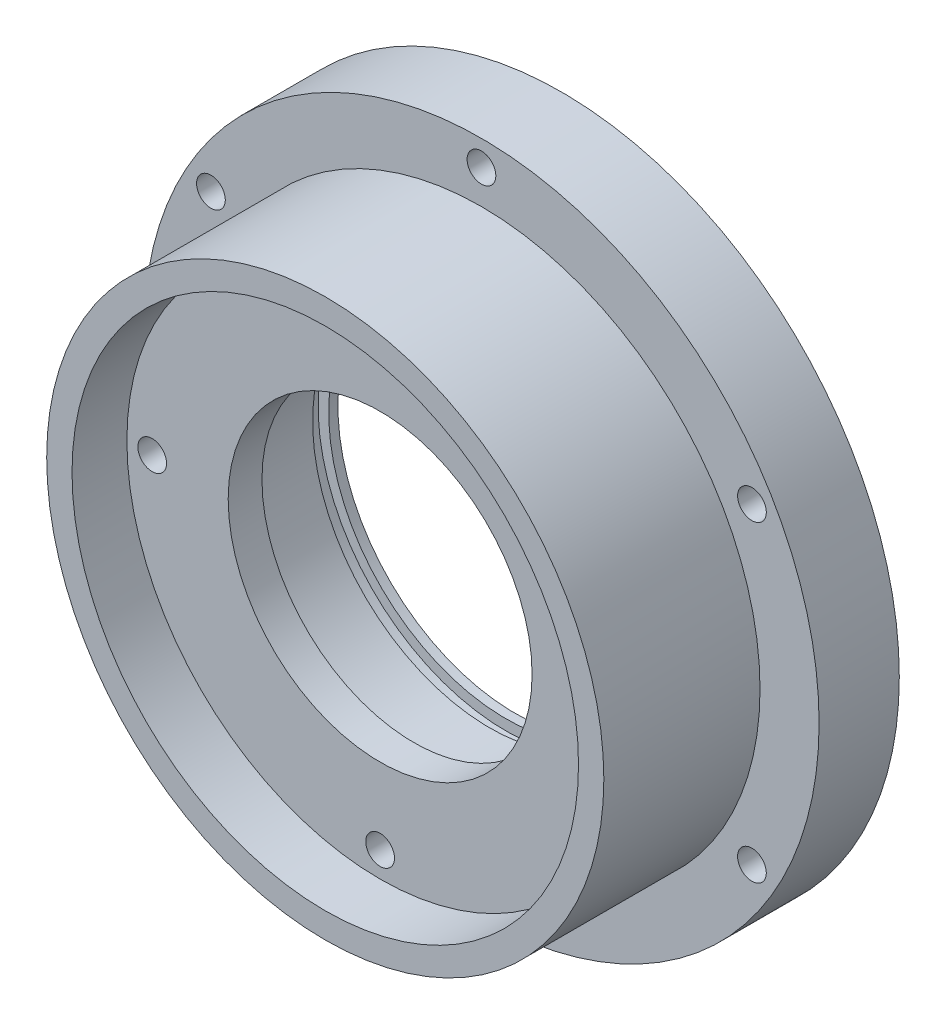
from build123d import *

# Parameters (mm, degrees)
SKETCH_6_R               = 1.7
CUT_EXTRUDE_1_DEPTH      = 64.118935352
PATTERN_CIRCULAR_1_COUNT = 6
CHAMFER_1_SIZE           = 0.5
PATTERN_CIRCULAR_2_COUNT = 4


with BuildPart() as part:
    # 草图1 → 旋转1 (revolve)
    with BuildSketch(Plane(origin=(0, 0, 0), x_dir=(0, 0, -1), z_dir=(1, 0, 0))):
        Polygon((0, 30), (0, 18), (4, 18), (4, 21), (13, 21), (13, 22.25), (14.9, 22.25), (14.9, 21), (16, 21), (16, 33), (21.5, 33), (21.5, 40), (12, 40), (12, 33), (-6.5, 33), (-6.5, 30), align=None)
    revolve(axis=Axis((0, 0, 0), (0, 0, -1)))

    # 草图2 → 切除-旋转2 (revolve, cut)
    with BuildSketch(Plane(origin=(0, 0, 0), x_dir=(0, 0, -1), z_dir=(1, 0, 0))):
        Polygon((0, 27), (16, 27), (16, 30), (4, 30), (4, 28.7), (0, 28.7), align=None)
    cut_revolve_2 = revolve(axis=Axis((0, 27, 0), (0, 0, -1)), mode=Mode.SUBTRACT)

    # 草图6 → 切除-拉伸1 (cut, symmetric)
    with BuildSketch(Plane(origin=(0, 0, -21.5), x_dir=(-1, 0, 0), z_dir=(0, 0, -1))):
        with Locations((0, 37)):
            Circle(SKETCH_6_R)
    cut_extrude_1 = extrude(amount=CUT_EXTRUDE_1_DEPTH, both=True, mode=Mode.SUBTRACT)

    # 阵列(圆周)1: 切除-拉伸1 ×6 about axis
    pattern_circular_1_axis = Axis((0, 0, -22.986810874), (0, 0, 1))
    for i in range(1, PATTERN_CIRCULAR_1_COUNT):
        add(cut_extrude_1.rotate(pattern_circular_1_axis, i * 360 / PATTERN_CIRCULAR_1_COUNT), mode=Mode.SUBTRACT)

    # 倒角1
    chamfer_1_edges = [part.edges().sort_by_distance(p)[0] for p in [
        (0, -33, -21.5),
    ]]
    chamfer(chamfer_1_edges, length=CHAMFER_1_SIZE)

    # 阵列(圆周)2: 切除-旋转2 ×4 about axis
    pattern_circular_2_axis = Axis((0, 0, -16), (0, 0, 1))
    for i in range(1, PATTERN_CIRCULAR_2_COUNT):
        add(cut_revolve_2.rotate(pattern_circular_2_axis, i * 360 / PATTERN_CIRCULAR_2_COUNT), mode=Mode.SUBTRACT)


solid = part.part
